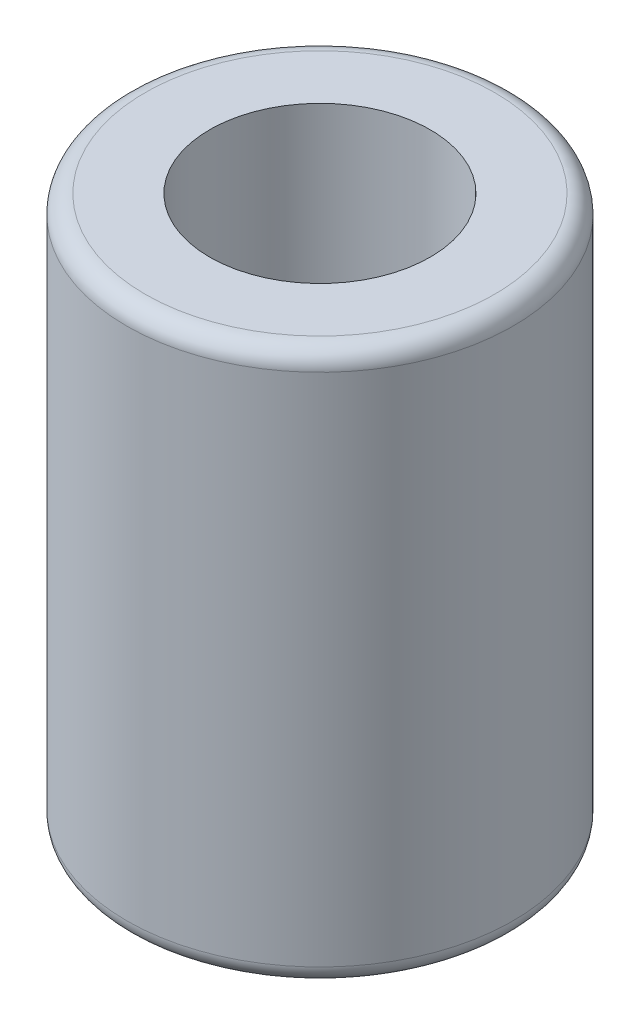
from build123d import *

# Parameters (mm, degrees)
SKETCH1_R           = 10.5
SKETCH1_R_2         = 6
BOSS_EXTRUDE1_DEPTH = 30
FILLET1_R           = 1


with BuildPart() as part:
    # Sketch1 → Boss-Extrude1 (new body)
    with BuildSketch(Plane(origin=(0, 0, 0), x_dir=(1, 0, 0), z_dir=(0, 1, 0))):
        with Locations(Location((0, 0, 0), (0, 0, 270))):
            Circle(SKETCH1_R)
        with Locations(Location((0, 0, 0), (0, 0, 270))):
            Circle(SKETCH1_R_2, mode=Mode.SUBTRACT)
    extrude(amount=BOSS_EXTRUDE1_DEPTH)

    # Fillet1
    fillet1_edges = [part.edges().sort_by_distance(p)[0] for p in [
        (0, 0, -10.5),
        (0, 30, -10.5),
    ]]
    fillet(fillet1_edges, radius=FILLET1_R)


solid = part.part
